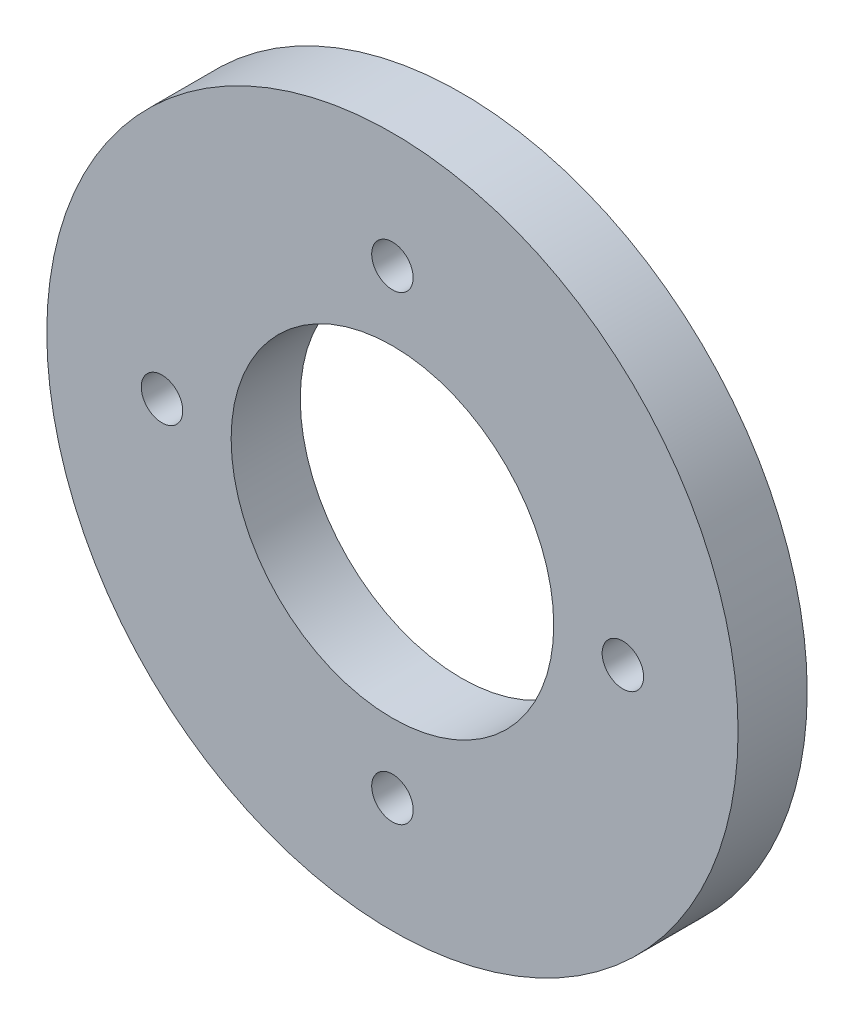
from build123d import *

# Parameters (mm, degrees)
SKETCH1_R           = 15
SKETCH1_R_2         = 0.9
BOSS_EXTRUDE1_DEPTH = 3
SKETCH2_R           = 7
CUT_EXTRUDE1_DEPTH  = 5.5


with BuildPart() as part:
    # Sketch1 → Boss-Extrude1 (new body)
    with BuildSketch(Plane.XY):
        Circle(SKETCH1_R)
        with Locations((0, -10)):
            Circle(SKETCH1_R_2, mode=Mode.SUBTRACT)
        with Locations((-10, 0)):
            Circle(SKETCH1_R_2, mode=Mode.SUBTRACT)
        with Locations((0, 10)):
            Circle(SKETCH1_R_2, mode=Mode.SUBTRACT)
        with Locations((10, 0)):
            Circle(SKETCH1_R_2, mode=Mode.SUBTRACT)
    extrude(amount=BOSS_EXTRUDE1_DEPTH)

    # Sketch2 → Cut-Extrude1 (cut)
    with BuildSketch(Plane(origin=(0, 0, 0), x_dir=(-1, 0, 0), z_dir=(0, 0, -1))):
        Circle(SKETCH2_R)
    extrude(amount=-CUT_EXTRUDE1_DEPTH, mode=Mode.SUBTRACT)


solid = part.part
